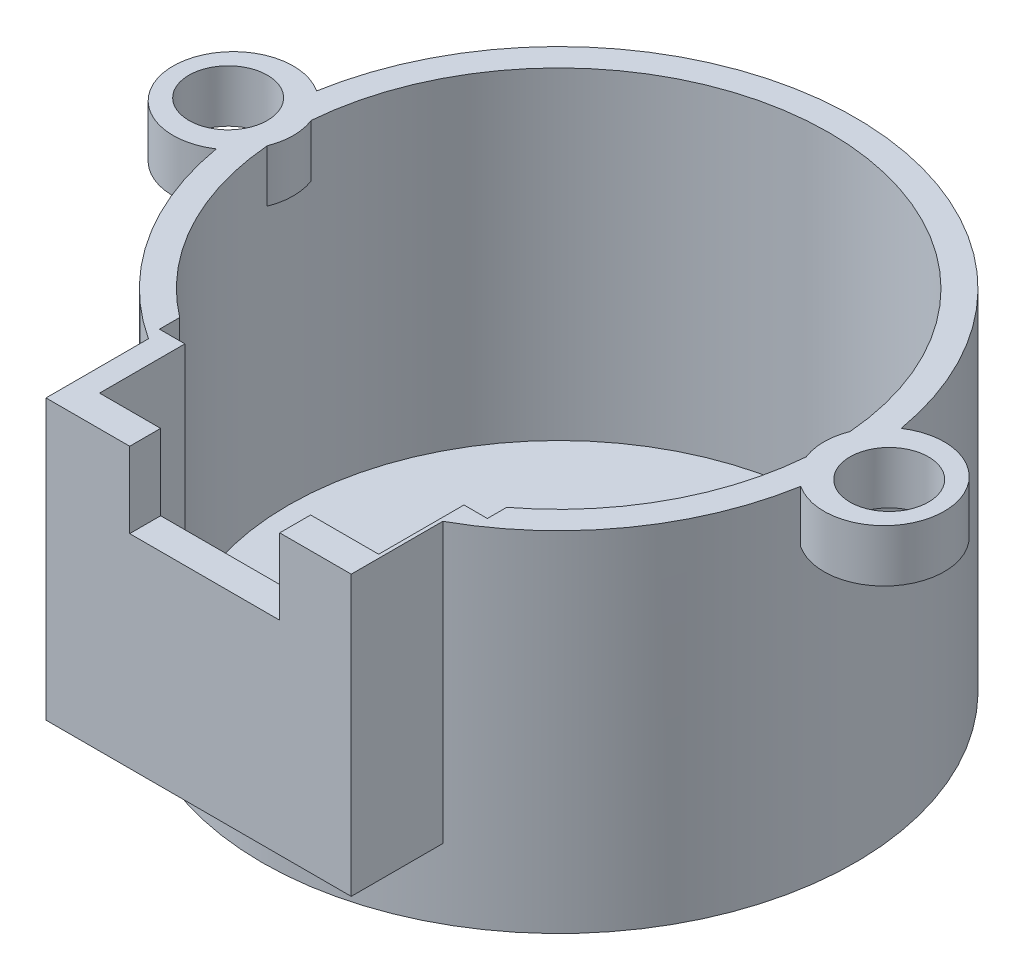
from build123d import *

# Parameters (mm, degrees)
SKETCH1_R           = 17
BOSS_EXTRUDE1_DEPTH = 20
SHELL1_T            = -1.5
SKETCH2_R           = 3.45
BOSS_EXTRUDE3_DEPTH = 3
SKETCH4_R           = 2.25
CUT_EXTRUDE1_DEPTH  = 3
SKETCH5_W           = 17.5
SKETCH5_H           = 7.7
BOSS_EXTRUDE4_DEPTH = 16
SKETCH6_W           = 16
SKETCH6_H           = 8.6
CUT_EXTRUDE2_DEPTH  = 14
SKETCH7_W           = 8.6
SKETCH7_H           = 5.8
CUT_EXTRUDE3_DEPTH  = 5
FILLET4_R           = 1
SKETCH8_W           = 18.8
SKETCH8_H           = 3
CUT_EXTRUDE4_DEPTH  = 16


with BuildPart() as part:
    # Sketch1 → Boss-Extrude1 (new body)
    with BuildSketch(Plane(origin=(0, 0, 0), x_dir=(1, 0, 0), z_dir=(0, 1, 0))):
        with Locations(Location((0, 0, 0), (0, 0, 270))):
            Circle(SKETCH1_R)
    extrude(amount=BOSS_EXTRUDE1_DEPTH)

    # Shell1
    shell1_openings = [part.faces().sort_by_distance(p)[0] for p in [
        (0, 20, 0),
    ]]
    offset(amount=SHELL1_T, openings=shell1_openings, kind=Kind.INTERSECTION)

    # Sketch2 → Boss-Extrude3 (add)
    with BuildSketch(Plane(origin=(0, 20, 0), x_dir=(1, 0, 0), z_dir=(0, 1, 0))):
        with Locations((18.659372003, 0)):
            Circle(SKETCH2_R)
        with Locations((-18.659372003, 0)):
            Circle(SKETCH2_R)
    extrude(amount=-BOSS_EXTRUDE3_DEPTH)

    # Sketch4 → Cut-Extrude1 (cut)
    with BuildSketch(Plane(origin=(0, 20, 0), x_dir=(1, 0, 0), z_dir=(0, 1, 0))):
        with Locations(Location((18.95, 0, 0), (0, 0, 270))):
            Circle(SKETCH4_R)
        with Locations(Location((-18.95, 0, 0), (0, 0, 331.816850826))):
            Circle(SKETCH4_R)
    extrude(amount=-CUT_EXTRUDE1_DEPTH, mode=Mode.SUBTRACT)

    # Sketch5 → Boss-Extrude4 (add)
    with BuildSketch(Plane(origin=(0, 20, 0), x_dir=(1, 0, 0), z_dir=(0, 1, 0))):
        with Locations((-0.520720203, -16.271905929)):
            Rectangle(SKETCH5_W, SKETCH5_H)
    extrude(amount=-BOSS_EXTRUDE4_DEPTH)

    # Sketch6 → Cut-Extrude2 (cut)
    with BuildSketch(Plane(origin=(0, 20, 0), x_dir=(1, 0, 0), z_dir=(0, 1, 0))):
        with Locations((0.025977535, -14.047647825)):
            Rectangle(SKETCH6_W, SKETCH6_H)
    extrude(amount=-CUT_EXTRUDE2_DEPTH, mode=Mode.SUBTRACT)

    # Sketch7 → Cut-Extrude3 (cut)
    with BuildSketch(Plane.XY.offset(20.121905929)):
        with Locations((-0.172487463, 18.560997168)):
            Rectangle(SKETCH7_W, SKETCH7_H)
    extrude(amount=-CUT_EXTRUDE3_DEPTH, mode=Mode.SUBTRACT)

    # Fillet4
    fillet4_edges = [part.edges().sort_by_distance(p)[0] for p in [
        (-0.520720203, 4, 12.421905929),
    ]]
    fillet(fillet4_edges, radius=FILLET4_R)

    # Sketch8 → Cut-Extrude4 (cut)
    with BuildSketch(Plane(origin=(0, 20, 0), x_dir=(1, 0, 0), z_dir=(0, 1, 0))):
        with Locations((-0.031709419, -11.955798022)):
            Rectangle(SKETCH8_W, SKETCH8_H)
    extrude(amount=-CUT_EXTRUDE4_DEPTH, mode=Mode.SUBTRACT)


solid = part.part
